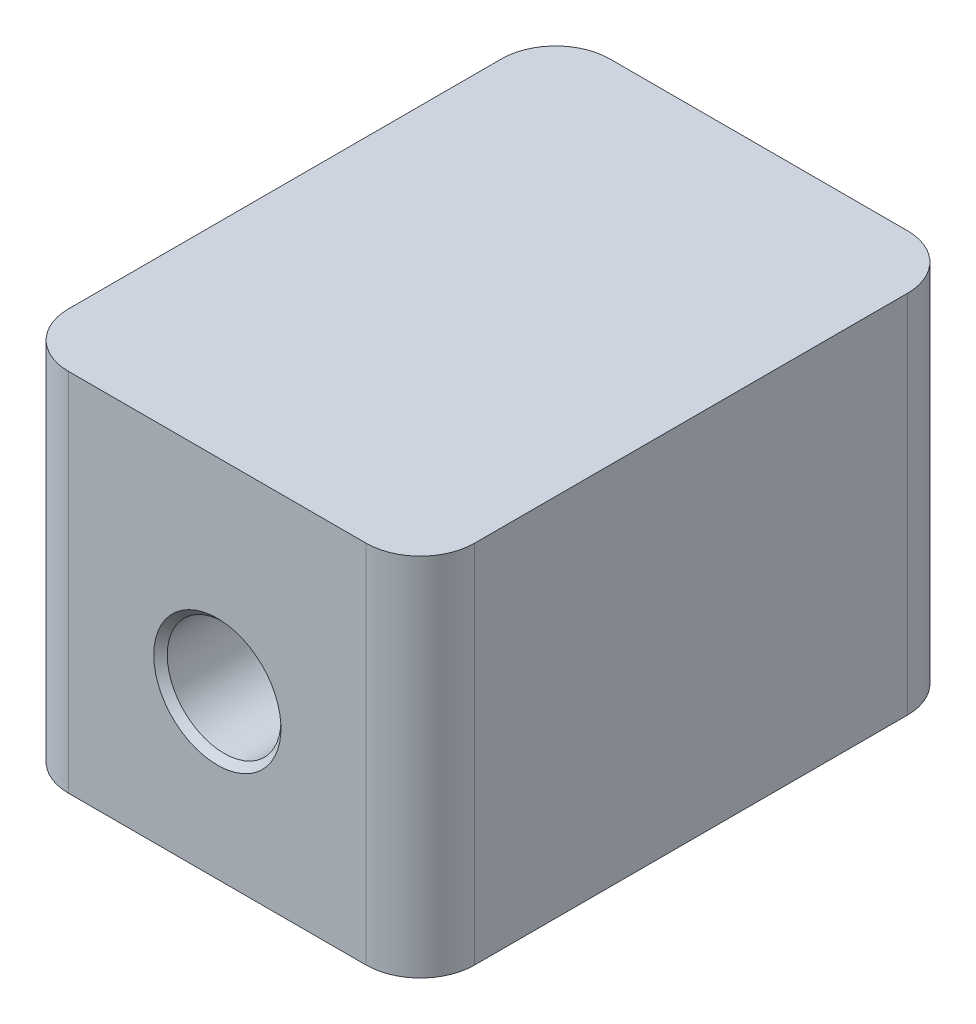
from build123d import *

# Parameters (mm, degrees)
SKETCH1_W                = 15
SKETCH1_H                = 13.5
BOSS_EXTRUDE1_DEPTH      = 10
FILLET1_R                = 2
M5_PORTS_D               = 4.2
M5_PORTS_DEPTH           = 5
M5_PORTS_ON_FACE_2_D     = 4.2
M5_PORTS_ON_FACE_2_DEPTH = 5
M5_PORT_CHAMFER_SIZE     = 0.25
SKETCH3_R                = 1.25
CUT_EXTRUDE1_DEPTH       = 4
CHAMFER2_SIZE            = 0.15


with BuildPart() as part:
    # Sketch1 → Boss-Extrude1 (new, symmetric)
    with BuildSketch(Plane.XY):
        with Locations((0, 0.75)):
            Rectangle(SKETCH1_W, SKETCH1_H)
    extrude(amount=BOSS_EXTRUDE1_DEPTH, both=True)

    # Fillet1
    fillet1_edges = [part.edges().sort_by_distance(p)[0] for p in [
        (-7.5, 0.75, -10),
        (7.5, 0.75, -10),
        (7.5, 0.75, 10),
        (-7.5, 0.75, 10),
    ]]
    fillet(fillet1_edges, radius=FILLET1_R)

    # M5 Ports
    with Locations(Plane.XY.offset(10)):
        with Locations((0, 0)):
            Hole(M5_PORTS_D / 2, depth=M5_PORTS_DEPTH)

    # M5 Ports on face 2
    with Locations(Plane(origin=(0, 0, -10), x_dir=(-1, 0, 0), z_dir=(0, 0, -1))):
        with Locations((0, 0)):
            Hole(M5_PORTS_ON_FACE_2_D / 2, depth=M5_PORTS_ON_FACE_2_DEPTH)

    # M5 Port Chamfer
    m5_port_chamfer_edges = [part.edges().sort_by_distance(p)[0] for p in [
        (-2.1, 0, -10),
        (2.1, 0, 10),
    ]]
    chamfer(m5_port_chamfer_edges, length=M5_PORT_CHAMFER_SIZE)

    # Sketch3 → Cut-Extrude1 (cut)
    with BuildSketch(Plane.XZ.offset(6)):
        with Locations((-5.5, 0)):
            Circle(SKETCH3_R)
        with Locations((5.5, 0)):
            Circle(SKETCH3_R)
    extrude(amount=-CUT_EXTRUDE1_DEPTH, mode=Mode.SUBTRACT)

    # Chamfer2
    chamfer2_edges = [part.edges().sort_by_distance(p)[0] for p in [
        (4.25, -6, 0),
        (-6.75, -6, 0),
    ]]
    chamfer(chamfer2_edges, length=CHAMFER2_SIZE)


solid = part.part
